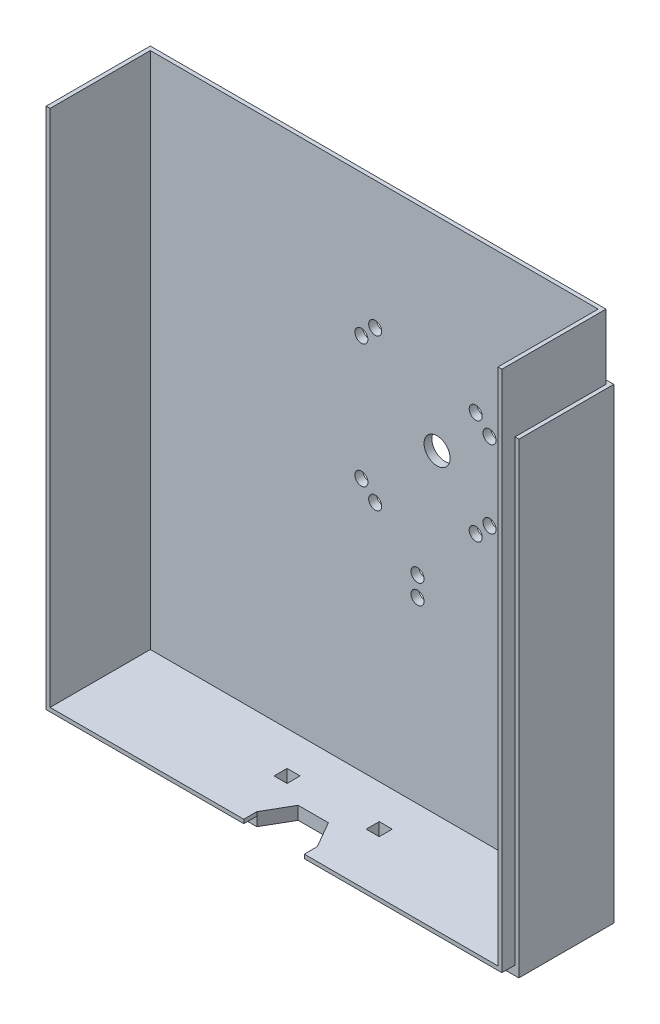
from build123d import *

# Parameters (mm, degrees)
SKETCH1_W           = 177.8
SKETCH1_H           = 254
BOSS_EXTRUDE1_DEPTH = 36.445
SHELL1_T            = 3
SKETCH2_R           = 22
CUT_EXTRUDE1_DEPTH  = 3
SKETCH3_R           = 5
SKETCH3_R_2         = 2.5
CUT_EXTRUDE2_DEPTH  = 3
SKETCH12_W          = 12
SKETCH12_H          = 66.89
BOSS_EXTRUDE5_DEPTH = 8
SKETCH10_R          = 3
CUT_EXTRUDE8_DEPTH  = 8
SKETCH13_W          = 174.8
SKETCH13_H          = 69.89
SKETCH13_W_2        = 171.8
SKETCH13_H_2        = 66.89
BOSS_EXTRUDE6_DEPTH = 25
SKETCH14_W          = 175.3
SKETCH14_H          = 70.39
SKETCH14_W_2        = 171.8
SKETCH14_H_2        = 66.89
CUT_EXTRUDE9_DEPTH  = 10
SKETCH17_W          = 171.8
SKETCH17_H          = 66.89
BOSS_EXTRUDE7_DEPTH = 2
SKETCH15_W          = 5
SKETCH15_H          = 5
CUT_EXTRUDE10_DEPTH = 5
BOSS_EXTRUDE8_DEPTH = 5


with BuildPart() as part:
    # Sketch1 → Boss-Extrude1 (new, symmetric)
    with BuildSketch(Plane.XY):
        Rectangle(SKETCH1_W, SKETCH1_H)
    extrude(amount=BOSS_EXTRUDE1_DEPTH, both=True)

    # Shell1 (no face opened: a closed hollow body)
    add(offset(amount=-SHELL1_T, mode=Mode.PRIVATE), mode=Mode.SUBTRACT)

    # Sketch2 → Cut-Extrude1 (cut)
    with BuildSketch(Plane(origin=(0, 0, 33.445), x_dir=(-1, 0, 0), z_dir=(0, 0, -1))):
        with Locations((0, -4)):
            Circle(SKETCH2_R)
    extrude(amount=-CUT_EXTRUDE1_DEPTH, mode=Mode.SUBTRACT)

    # Sketch3 → Cut-Extrude2 (cut)
    with BuildSketch(Plane.XY.offset(-33.445)):
        with Locations((24.1, -1)):
            Circle(SKETCH3_R)
        with Locations((44.229314747, 13.826013888)):
            Circle(SKETCH3_R_2)
        with Locations((38.926013888, 19.129314747)):
            Circle(SKETCH3_R_2)
        with Locations(Location((38.926013888, -21.129314747, 0), (0, 0, 180))):
            Circle(SKETCH3_R_2)
        with Locations(Location((44.229314747, -15.826013888, 0), (0, 0, 180))):
            Circle(SKETCH3_R_2)
        with Locations((0.36806178, 28.035239078)):
            Circle(SKETCH3_R_2)
        with Locations((-4.935239078, 22.73193822)):
            Circle(SKETCH3_R_2)
        with Locations(Location((-4.935239078, -24.73193822, 0), (0, 0, 180))):
            Circle(SKETCH3_R_2)
        with Locations(Location((0.36806178, -30.035239078, 0), (0, 0, 180))):
            Circle(SKETCH3_R_2)
        with Locations((16.6, -46)):
            Circle(SKETCH3_R_2)
        with Locations((16.6, -53.5)):
            Circle(SKETCH3_R_2)
    extrude(amount=-CUT_EXTRUDE2_DEPTH, mode=Mode.SUBTRACT)

    # Sketch12 → Boss-Extrude5 (add)
    with BuildSketch(Plane.XZ.offset(-124)):
        Rectangle(SKETCH12_W, SKETCH12_H)
    extrude(amount=BOSS_EXTRUDE5_DEPTH)

    # Sketch10 → Cut-Extrude8 (cut)
    with BuildSketch(Plane(origin=(0, 127, 0), x_dir=(1, 0, 0), z_dir=(0, 1, 0))):
        with Locations(Location((0, 0, 0), (0, 0, 270))):
            Circle(SKETCH10_R)
    extrude(amount=-CUT_EXTRUDE8_DEPTH, mode=Mode.SUBTRACT)


with BuildPart() as body_2:
    # Split2: the piece on the far side of the plane
    add(part.part)
    split(bisect_by=Plane.ZX.offset(52), keep=Keep.BOTTOM)

    # Sketch13 → Boss-Extrude6 (add)
    with BuildSketch(Plane(origin=(0, 52, 0), x_dir=(1, 0, 0), z_dir=(0, 1, 0))):
        Rectangle(SKETCH13_W, SKETCH13_H)
        Rectangle(SKETCH13_W_2, SKETCH13_H_2, mode=Mode.SUBTRACT)
    extrude(amount=BOSS_EXTRUDE6_DEPTH)

    # Sketch17 → Boss-Extrude7 (add)
    with BuildSketch(Plane(origin=(0, -124, 0), x_dir=(1, 0, 0), z_dir=(0, 1, 0))):
        Rectangle(SKETCH17_W, SKETCH17_H)
    extrude(amount=BOSS_EXTRUDE7_DEPTH)

    # Sketch15 → Cut-Extrude10 (cut)
    with BuildSketch(Plane.XZ.offset(127)):
        Polygon((11.604740411, 0), (5.802370205, 10.05), (-5.802370205, 10.05), (-11.604740411, 0), (-5.802370205, -10.05), (5.802370205, -10.05), align=None)
        with Locations((-17.67766953, 17.67766953)):
            Rectangle(SKETCH15_W, SKETCH15_H)
        with Locations((17.67766953, 17.67766953)):
            Rectangle(SKETCH15_W, SKETCH15_H)
        with Locations((17.67766953, -17.67766953)):
            Rectangle(SKETCH15_W, SKETCH15_H)
        with Locations((-17.67766953, -17.67766953)):
            Rectangle(SKETCH15_W, SKETCH15_H)
    extrude(amount=-CUT_EXTRUDE10_DEPTH, mode=Mode.SUBTRACT)


with BuildPart() as part_1:
    add(part.part)

    # Split2
    split(bisect_by=Plane.ZX.offset(52), keep=Keep.TOP)

    # Sketch14 → Cut-Extrude9 (cut)
    with BuildSketch(Plane.XZ.offset(-52)):
        Rectangle(SKETCH14_W, SKETCH14_H)
        Rectangle(SKETCH14_W_2, SKETCH14_H_2, mode=Mode.SUBTRACT)
    extrude(amount=-CUT_EXTRUDE9_DEPTH, mode=Mode.SUBTRACT)


with BuildPart() as body_3:
    # Split3: the piece on the far side of the plane
    add(body_2.part)
    split(bisect_by=Plane.XY, keep=Keep.BOTTOM)

    # Sketch19 → Boss-Extrude8 (add)
    with BuildSketch(Plane.XY):
        Polygon((-87.4, 77), (-85.9, 77), (-85.9, 75.5), (-85.9, -122), (-11.604740411, -122), (-11.604740411, -123.5), (-87.4, -123.5), align=None)
        Polygon((87.4, 77), (87.4, -123.5), (11.604740411, -123.5), (11.604740411, -122), (85.9, -122), (85.9, 75.5), (85.9, 77), align=None)
    extrude(amount=BOSS_EXTRUDE8_DEPTH)


with BuildPart() as body_2_1:
    add(body_2.part)

    # Split3
    split(bisect_by=Plane.XY, keep=Keep.TOP)


solid = body_3.part
